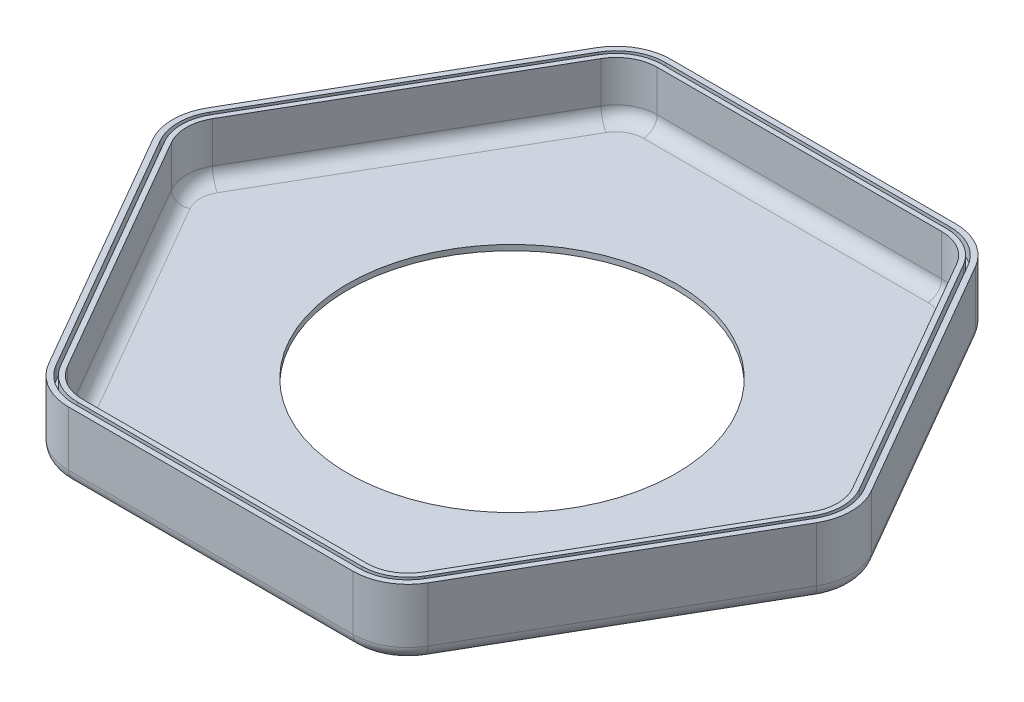
from build123d import *

# Parameters (mm, degrees)
SALIENTE_EXTRUIR2_DEPTH = 5
SALIENTE_EXTRUIR3_DEPTH = 20
REDONDEO2_R             = 5
REDONDEO3_R             = 5
CROQUIS4_R              = 60
CORTAR_EXTRUIR1_DEPTH   = 10
CROQUIS3_R              = 90
CORTAR_EXTRUIR2_DEPTH   = 3
CORTAR_EXTRUIR3_DEPTH   = 5


with BuildPart() as part:
    # Croquis1 → Saliente-Extruir2 (new body)
    with BuildSketch(Plane(origin=(0, 0, 0), x_dir=(1, 0, 0), z_dir=(0, 1, 0))):
        with BuildLine():
            Line((-119.224191345, -9.394190445), (-67.262667118, -99.394190445))
            ThreePointArc((-67.262667118, -99.394190445), (-59.942159042, -106.71469852), (-49.942159042, -109.394190445))
            Line((-49.942159042, -109.394190445), (53.980889412, -109.394190445))
            ThreePointArc((53.980889412, -109.394190445), (63.980889412, -106.71469852), (71.301397487, -99.394190445))
            Line((71.301397487, -99.394190445), (123.262921714, -9.394190445))
            ThreePointArc((123.262921714, -9.394190445), (125.942413639, 0.605809555), (123.262921714, 10.605809555))
            Line((123.262921714, 10.605809555), (71.301397487, 100.605809555))
            ThreePointArc((71.301397487, 100.605809555), (63.980889412, 107.926317631), (53.980889412, 110.605809555))
            Line((53.980889412, 110.605809555), (-49.942159042, 110.605809555))
            ThreePointArc((-49.942159042, 110.605809555), (-59.942159042, 107.926317631), (-67.262667118, 100.605809555))
            Line((-67.262667118, 100.605809555), (-119.224191345, 10.605809555))
            ThreePointArc((-119.224191345, 10.605809555), (-121.90368327, 0.605809555), (-119.224191345, -9.394190445))
        make_face()
    extrude(amount=SALIENTE_EXTRUIR2_DEPTH)

    # Croquis2 → Saliente-Extruir3 (add)
    with BuildSketch(Plane(origin=(0, 5, 0), x_dir=(1, 0, 0), z_dir=(0, 1, 0))):
        with BuildLine():
            Line((-67.262667118, 100.605809555), (-119.224191345, 10.605809555))
            ThreePointArc((-119.224191345, 10.605809555), (-121.90368327, 0.605809555), (-119.224191345, -9.394190445))
            Line((-119.224191345, -9.394190445), (-67.262667118, -99.394190445))
            ThreePointArc((-67.262667118, -99.394190445), (-59.942159042, -106.71469852), (-49.942159042, -109.394190445))
            Line((-49.942159042, -109.394190445), (53.980889412, -109.394190445))
            ThreePointArc((53.980889412, -109.394190445), (63.980889412, -106.71469852), (71.301397487, -99.394190445))
            Line((71.301397487, -99.394190445), (123.262921714, -9.394190445))
            ThreePointArc((123.262921714, -9.394190445), (125.942413639, 0.605809555), (123.262921714, 10.605809555))
            Line((123.262921714, 10.605809555), (71.301397487, 100.605809555))
            ThreePointArc((71.301397487, 100.605809555), (63.980889412, 107.926317631), (53.980889412, 110.605809555))
            Line((53.980889412, 110.605809555), (-49.942159042, 110.605809555))
            ThreePointArc((-49.942159042, 110.605809555), (-59.942159042, 107.926317631), (-67.262667118, 100.605809555))
        make_face()
        with BuildLine():
            Line((-62.932540099, 98.105809555), (-114.894064326, 8.105809555))
            ThreePointArc((-114.894064326, 8.105809555), (-116.90368327, 0.605809555), (-114.894064326, -6.894190445))
            Line((-114.894064326, -6.894190445), (-62.932540099, -96.894190445))
            ThreePointArc((-62.932540099, -96.894190445), (-57.442159042, -102.384571501), (-49.942159042, -104.394190445))
            Line((-49.942159042, -104.394190445), (53.980889412, -104.394190445))
            ThreePointArc((53.980889412, -104.394190445), (61.480889412, -102.384571501), (66.971270468, -96.894190445))
            Line((66.971270468, -96.894190445), (118.932794695, -6.894190445))
            ThreePointArc((118.932794695, -6.894190445), (120.942413639, 0.605809555), (118.932794695, 8.105809555))
            Line((118.932794695, 8.105809555), (66.971270468, 98.105809555))
            ThreePointArc((66.971270468, 98.105809555), (61.480889412, 103.596190612), (53.980889412, 105.605809555))
            Line((53.980889412, 105.605809555), (-49.942159042, 105.605809555))
            ThreePointArc((-49.942159042, 105.605809555), (-57.442159042, 103.596190612), (-62.932540099, 98.105809555))
        make_face(mode=Mode.SUBTRACT)
    extrude(amount=SALIENTE_EXTRUIR3_DEPTH)

    # Redondeo2
    redondeo2_edges = [part.edges().sort_by_distance(p)[0] for p in [
        (2.019365185, 0, -110.605809555),
        (63.980889412, 0, -107.926317631),
        (97.282159601, 0, -55.605809555),
        (125.942413639, 0, -0.605809555),
        (97.282159601, 0, 54.394190445),
        (63.980889412, 0, 106.71469852),
        (2.019365185, 0, 109.394190445),
        (-59.942159042, 0, 106.71469852),
        (-93.243429232, 0, 54.394190445),
        (-121.90368327, 0, -0.605809555),
        (-93.243429232, 0, -55.605809555),
        (-59.942159042, 0, -107.926317631),
    ]]
    fillet(redondeo2_edges, radius=REDONDEO2_R)

    # Redondeo3
    redondeo3_edges = [part.edges().sort_by_distance(p)[0] for p in [
        (-57.442159042, 5, -103.596190612),
        (-88.913302213, 5, -53.105809555),
        (-116.90368327, 5, -0.605809555),
        (-88.913302213, 5, 51.894190445),
        (-57.442159042, 5, 102.384571501),
        (2.019365185, 5, 104.394190445),
        (61.480889412, 5, 102.384571501),
        (92.952032582, 5, 51.894190445),
        (120.942413639, 5, -0.605809555),
        (92.952032582, 5, -53.105809555),
        (61.480889412, 5, -103.596190612),
        (2.019365185, 5, -105.605809555),
    ]]
    fillet(redondeo3_edges, radius=REDONDEO3_R)

    # Croquis4 → Cortar-Extruir1 (cut)
    with BuildSketch(Plane(origin=(0, 0, 0), x_dir=(-1, 0, 0), z_dir=(0, -1, 0))):
        with Locations(Location((-2.019365185, 0.605809555, 0), (0, 0, 90))):
            Circle(CROQUIS4_R)
    extrude(amount=-CORTAR_EXTRUIR1_DEPTH, mode=Mode.SUBTRACT)

    # Croquis3 → Cortar-Extruir2 (cut)
    with BuildSketch(Plane.XZ):
        with Locations(Location((2.019365185, -0.605809555, 0), (0, 0, 270))):
            Circle(CROQUIS3_R)
    extrude(amount=-CORTAR_EXTRUIR2_DEPTH, mode=Mode.SUBTRACT)

    # Croquis5 → Cortar-Extruir3 (cut)
    with BuildSketch(Plane(origin=(0, 25, 0), x_dir=(1, 0, 0), z_dir=(0, 1, 0))):
        with BuildLine():
            Line((-65.530616311, 99.605809555), (-117.492140538, 9.605809555))
            ThreePointArc((-117.492140538, 9.605809555), (-119.90368327, 0.605809555), (-117.492140538, -8.394190445))
            Line((-117.492140538, -8.394190445), (-65.530616311, -98.394190445))
            ThreePointArc((-65.530616311, -98.394190445), (-58.942159042, -104.982647713), (-49.942159042, -107.394190445))
            Line((-49.942159042, -107.394190445), (53.980889412, -107.394190445))
            ThreePointArc((53.980889412, -107.394190445), (62.980889412, -104.982647713), (69.56934668, -98.394190445))
            Line((69.56934668, -98.394190445), (121.530870907, -8.394190445))
            ThreePointArc((121.530870907, -8.394190445), (123.942413639, 0.605809555), (121.530870907, 9.605809555))
            Line((121.530870907, 9.605809555), (69.56934668, 99.605809555))
            ThreePointArc((69.56934668, 99.605809555), (62.980889412, 106.194266823), (53.980889412, 108.605809555))
            Line((53.980889412, 108.605809555), (-49.942159042, 108.605809555))
            ThreePointArc((-49.942159042, 108.605809555), (-58.942159042, 106.194266823), (-65.530616311, 99.605809555))
        make_face()
        with BuildLine():
            Line((-64.491385826, 99.005809555), (-116.452910053, 9.005809555))
            ThreePointArc((-116.452910053, 9.005809555), (-118.70368327, 0.605809555), (-116.452910053, -7.794190445))
            Line((-116.452910053, -7.794190445), (-64.491385826, -97.794190445))
            ThreePointArc((-64.491385826, -97.794190445), (-58.342159042, -103.943417228), (-49.942159042, -106.194190445))
            Line((-49.942159042, -106.194190445), (53.980889412, -106.194190445))
            ThreePointArc((53.980889412, -106.194190445), (62.380889412, -103.943417228), (68.530116195, -97.794190445))
            Line((68.530116195, -97.794190445), (120.491640422, -7.794190445))
            ThreePointArc((120.491640422, -7.794190445), (122.742413639, 0.605809555), (120.491640422, 9.005809555))
            Line((120.491640422, 9.005809555), (68.530116195, 99.005809555))
            ThreePointArc((68.530116195, 99.005809555), (62.380889412, 105.155036339), (53.980889412, 107.405809555))
            Line((53.980889412, 107.405809555), (-49.942159042, 107.405809555))
            ThreePointArc((-49.942159042, 107.405809555), (-58.342159042, 105.155036339), (-64.491385826, 99.005809555))
        make_face(mode=Mode.SUBTRACT)
    extrude(amount=-CORTAR_EXTRUIR3_DEPTH, mode=Mode.SUBTRACT)


solid = part.part
